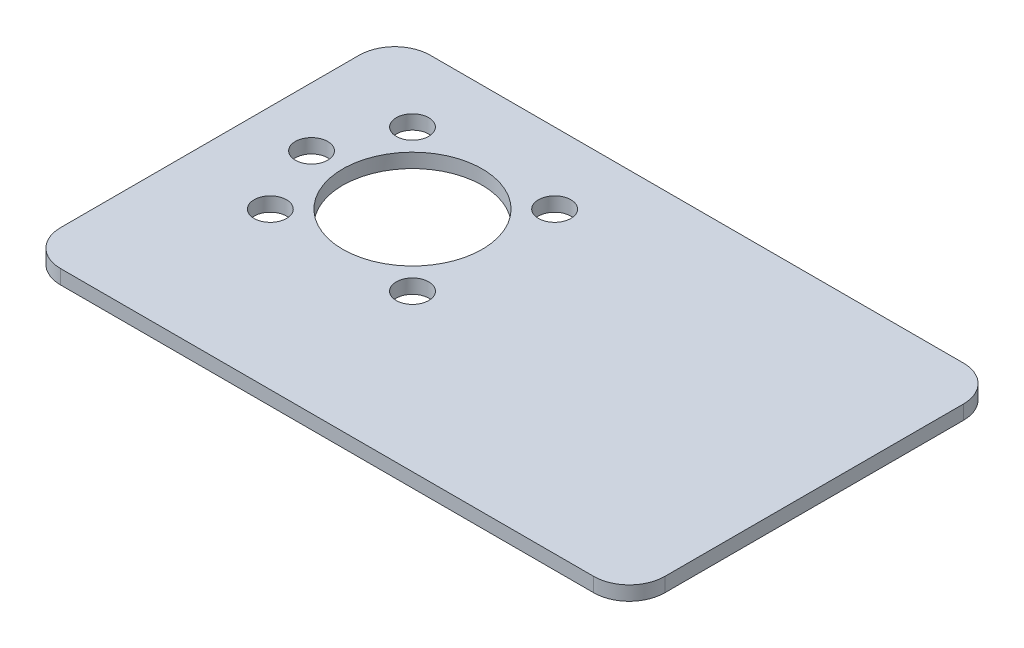
from build123d import *

# Parameters (mm, degrees)
SKETCH1_W                   = 107.95
SKETCH1_H                   = 66.04
BOSS_EXTRUDE1_DEPTH         = 2.54
M5_CLEARANCE_HOLE1_D        = 5.8
F_97_0_981_DIAMETER_HOLE1_D = 24.9174
FILLET1_R                   = 6.35


with BuildPart() as part:
    # Sketch1 → Boss-Extrude1 (new body)
    with BuildSketch(Plane(origin=(0, 0, 0), x_dir=(1, 0, 0), z_dir=(0, 1, 0))):
        with Locations((53.975, 33.02)):
            Rectangle(SKETCH1_W, SKETCH1_H)
    extrude(amount=BOSS_EXTRUDE1_DEPTH)

    # M5 Clearance Hole1 (through all)
    with Locations(Plane(origin=(0, 2.54, 0), x_dir=(1, 0, 0), z_dir=(0, 1, 0))):
        with Locations((15.875, 53.34), (41.275, 53.34), (41.275, 27.94), (15.875, 27.94), (10.541, 40.64)):
            Hole(M5_CLEARANCE_HOLE1_D / 2)

    # #97 (0.981) Diameter Hole1 (through all)
    with Locations(Plane(origin=(0, 2.54, 0), x_dir=(1, 0, 0), z_dir=(0, 1, 0))):
        with Locations((28.575, 40.64)):
            Hole(F_97_0_981_DIAMETER_HOLE1_D / 2)

    # Fillet1
    fillet1_edges = [part.edges().sort_by_distance(p)[0] for p in [
        (0, 1.27, -66.04),
        (107.95, 1.27, -66.04),
        (107.95, 1.27, 0),
        (0, 1.27, 0),
    ]]
    fillet(fillet1_edges, radius=FILLET1_R)


solid = part.part
